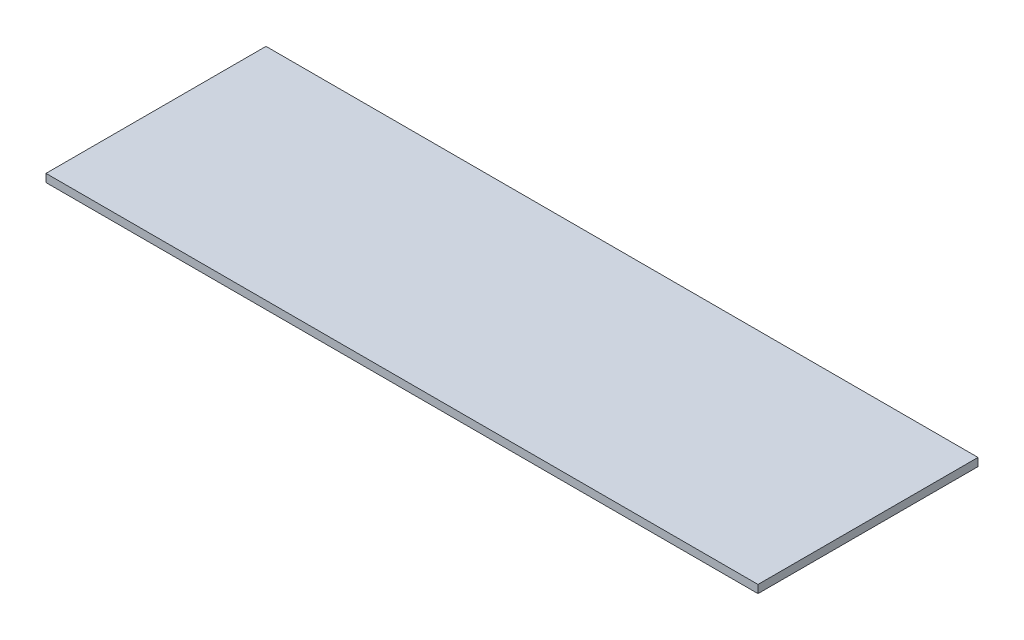
from build123d import *

# Parameters (mm, degrees)
SKETCH1_W           = 178
SKETCH1_H           = 55
BOSS_EXTRUDE1_DEPTH = 2


with BuildPart() as part:
    # Sketch1 → Boss-Extrude1 (new body)
    with BuildSketch(Plane(origin=(0, 0, 0), x_dir=(1, 0, 0), z_dir=(0, 1, 0))):
        Rectangle(SKETCH1_W, SKETCH1_H)
    extrude(amount=BOSS_EXTRUDE1_DEPTH)


solid = part.part
